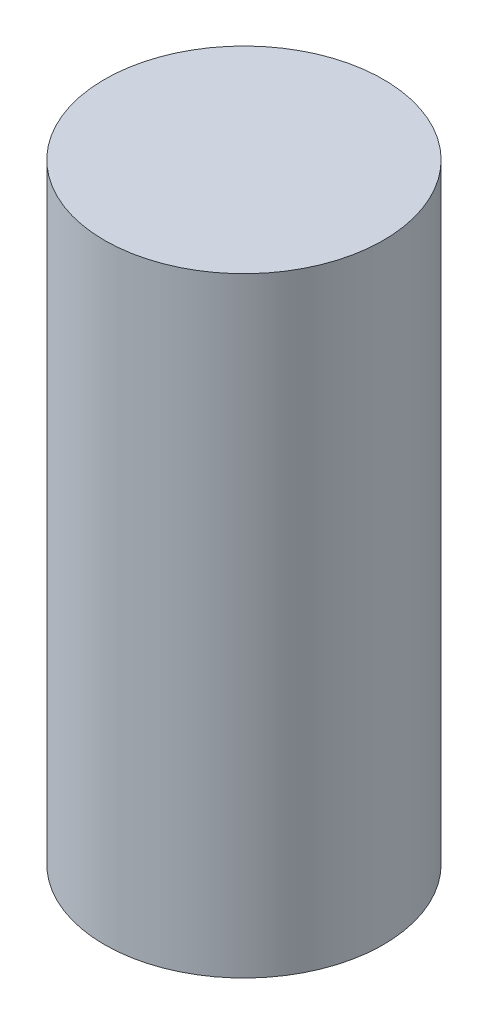
from build123d import *

# Parameters (mm, degrees)
SKETCH1_R           = 228.6
BOSS_EXTRUDE1_DEPTH = 1000


with BuildPart() as part:
    # Sketch1 → Boss-Extrude1 (new body)
    with BuildSketch(Plane(origin=(0, 0, 0), x_dir=(1, 0, 0), z_dir=(0, 1, 0))):
        with Locations(Location((0, 0, 0), (0, 0, 270))):
            Circle(SKETCH1_R)
    extrude(amount=BOSS_EXTRUDE1_DEPTH)


solid = part.part
